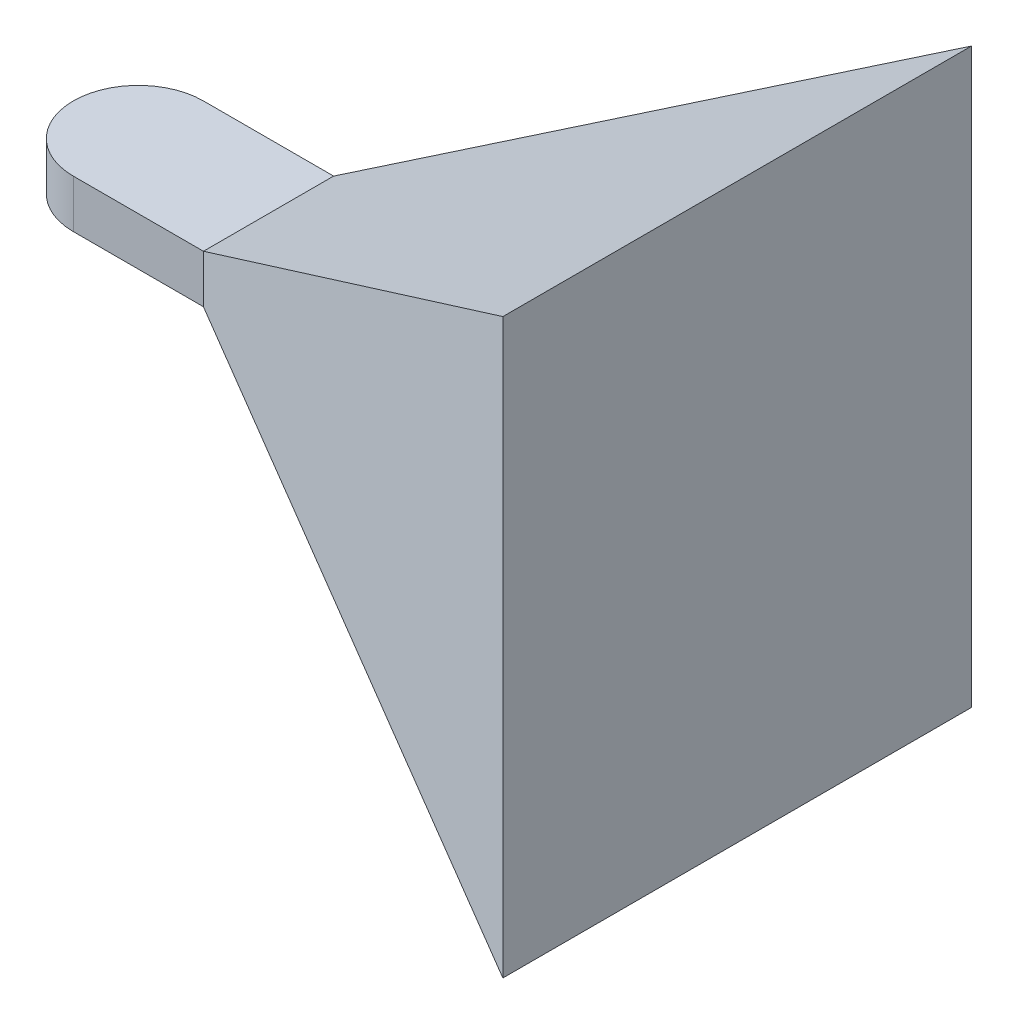
from build123d import *

# Parameters (mm, degrees)
BOSS_EXTRUDE1_DEPTH      = 139.7
BOSS_EXTRUDE1_DEPTH_BACK = 139.7
CUT_EXTRUDE1_DEPTH       = 139.7
CUT_EXTRUDE1_DEPTH_BACK  = 139.7


with BuildPart() as part:
    # Sketch1 → Boss-Extrude1 (new, two sides: drawn at the far end of the back side and taken through both)
    with BuildSketch(Plane(origin=(0, 0, 0), x_dir=(1, 0, 0), z_dir=(0, 1, 0)).offset(-BOSS_EXTRUDE1_DEPTH_BACK)):
        with BuildLine():
            Line((0, 31.75), (63.5, 31.75))
            Line((63.5, 31.75), (292.1, 114.3))
            Line((292.1, 114.3), (292.1, -114.3))
            Line((292.1, -114.3), (63.5, -31.75))
            Line((63.5, -31.75), (0, -31.75))
            ThreePointArc((0, -31.75), (-31.75, 0), (0, 31.75))
        make_face()
    extrude(amount=BOSS_EXTRUDE1_DEPTH + BOSS_EXTRUDE1_DEPTH_BACK)

    # Sketch2 → Cut-Extrude1 (cut, two sides: drawn at the far end of the back side and taken through both)
    with BuildSketch(Plane.XY.offset(-CUT_EXTRUDE1_DEPTH_BACK)):
        Polygon((-31.75, 11.723949014), (63.5, 11.723949014), (292.1, 139.7), (-31.75, 139.7), align=None)
        Polygon((63.5, -11.723949014), (292.1, -139.7), (-31.75, -139.7), (-31.75, -11.723949014), align=None)
    extrude(amount=CUT_EXTRUDE1_DEPTH + CUT_EXTRUDE1_DEPTH_BACK, mode=Mode.SUBTRACT)


solid = part.part
